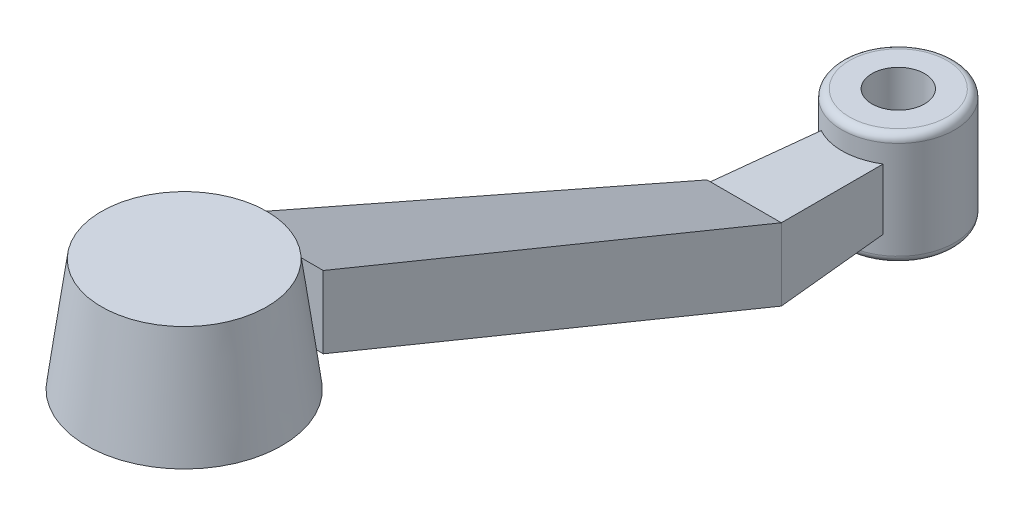
from build123d import *

# Parameters (mm, degrees)
CROQUIS4_R                        = 15
CROQUIS4_R_2                      = 7
SALIENTE_EXTRUIR1_DEPTH           = 30
REDONDEO1_R                       = 2
CROQUIS8_W                        = 16.152237462
CROQUIS8_H                        = 16.481036189
SALIENTE_EXTRUIR2_DEPTH           = 26
SALIENTE_EXTRUIR2_TAPER           = -3
SALIENTE_EXTRUIR2_OTHER_WAY_DEPTH = 5
SALIENTE_EXTRUIR2_OTHER_WAY_TAPER = 3
SALIENTE_EXTRUIR4_DEPTH           = 21.4
CORTAR_EXTRUIR2_DEPTH             = 100.8


with BuildPart() as part:
    # Croquis4 → Saliente-Extruir1 (new body)
    with BuildSketch(Plane(origin=(0, 0, 0), x_dir=(1, 0, 0), z_dir=(0, 1, 0))):
        Circle(CROQUIS4_R)
        Circle(CROQUIS4_R_2, mode=Mode.SUBTRACT)
    extrude(amount=SALIENTE_EXTRUIR1_DEPTH)

    # Redondeo1
    redondeo1_edges = [part.edges().sort_by_distance(p)[0] for p in [
        (-15, 0, 0),
        (-15, 30, 0),
    ]]
    fillet(redondeo1_edges, radius=REDONDEO1_R)

    # Croquis8 → Saliente-Extruir2 (add)
    with BuildSketch(Plane.XY.offset(15)):
        with Locations((0.446006576, 14.964559515)):
            Rectangle(CROQUIS8_W, CROQUIS8_H)
    extrude(amount=SALIENTE_EXTRUIR2_DEPTH, taper=SALIENTE_EXTRUIR2_TAPER)

    # Croquis8 → Saliente-Extruir2 other way (add)
    with BuildSketch(Plane.XY.offset(15)):
        with Locations((0.446006576, 14.964559515)):
            Rectangle(CROQUIS8_W, CROQUIS8_H)
    extrude(amount=-SALIENTE_EXTRUIR2_OTHER_WAY_DEPTH, taper=SALIENTE_EXTRUIR2_OTHER_WAY_TAPER)

    # Croquis9 → Saliente-Extruir4 (add, symmetric)
    with BuildSketch(Plane(origin=(0, 0, 0), x_dir=(0, 0, -1), z_dir=(1, 0, 0))):
        Polygon((-41, 24.567679871), (-41, 5.361439159), (-166, 58.420791186), (-166, 77.627031898), align=None)
    extrude(amount=SALIENTE_EXTRUIR4_DEPTH, both=True)

    # Croquis12 → Cortar-Extruir2 (cut, symmetric)
    with BuildSketch(Plane(origin=(0, 50, 0), x_dir=(1, 0, 0), z_dir=(0, 1, 0))):
        Polygon((9.884727568, -41), (13, -166), (33.350069365, -166), (33.350069365, -41), align=None)
    cortar_extruir2 = extrude(amount=CORTAR_EXTRUIR2_DEPTH, both=True, mode=Mode.SUBTRACT)

    # Simetría3: Cortar-Extruir2 across plane
    add(cortar_extruir2.mirror(Plane(origin=(0, 0, 0), x_dir=(0, 0, 1), z_dir=(1, 0, 0))), mode=Mode.SUBTRACT)

    # Croquis14 → Revolución1 (revolve)
    with BuildSketch(Plane(origin=(0, 0, 0), x_dir=(0, 0, -1), z_dir=(1, 0, 0))):
        Polygon((-190, 85.754128646), (-212, 85.754128646), (-216, 55.754128646), (-190, 55.754128646), align=None)
    revolve(axis=Axis((0, 79.990867655, 190), (0, 1, 0)))


solid = part.part
